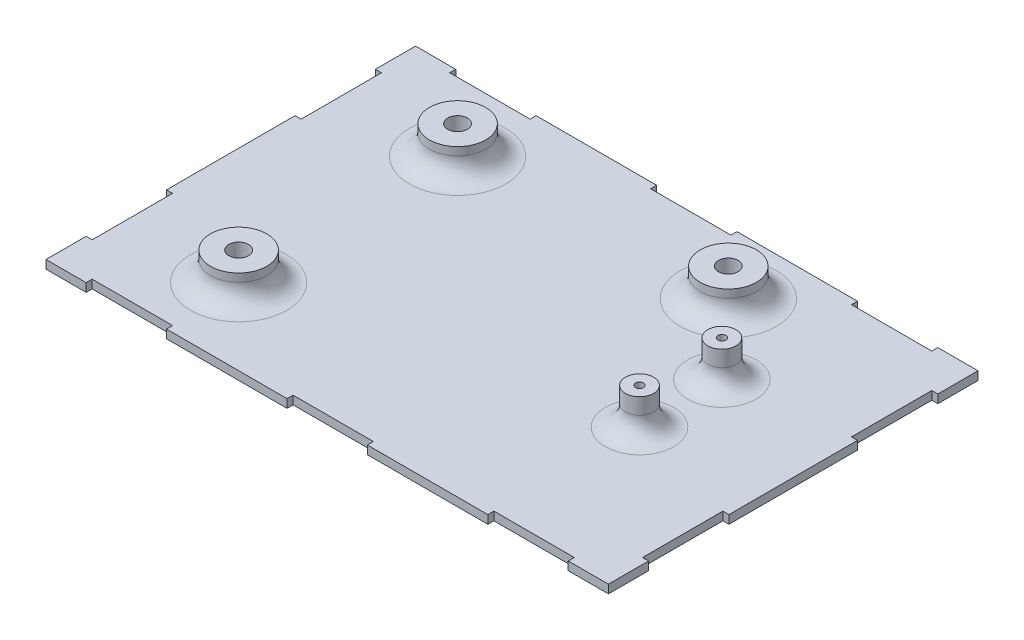
from build123d import *

# Parameters (mm, degrees)
SKETCH1_W           = 140
SKETCH1_H           = 92
BOSS_EXTRUDE1_DEPTH = 2.1
SKETCH2_W           = 1.5
SKETCH2_H           = 20
SKETCH2_W_2         = 20
SKETCH2_H_2         = 1.5
CUT_EXTRUDE1_DEPTH  = 84.787886953
SKETCH3_R           = 7
SKETCH3_R_2         = 3.5
BOSS_EXTRUDE2_DEPTH = 7
SKETCH6_R           = 3.5
BOSS_EXTRUDE3_DEPTH = 2
SKETCH7_R           = 2.45
CUT_EXTRUDE4_DEPTH  = 5.1
SKETCH8_R           = 1
CUT_EXTRUDE5_DEPTH  = 7
FILLET1_R           = 5


with BuildPart() as part:
    # Sketch1 → Boss-Extrude1 (new body)
    with BuildSketch(Plane(origin=(0, 0, 0), x_dir=(1, 0, 0), z_dir=(0, 1, 0))):
        Rectangle(SKETCH1_W, SKETCH1_H)
    extrude(amount=BOSS_EXTRUDE1_DEPTH)

    # Sketch2 → Cut-Extrude1 (cut, through all)
    with BuildSketch(Plane(origin=(0, 2.1, 0), x_dir=(1, 0, 0), z_dir=(0, 1, 0))):
        with Locations((69.25, 26)):
            Rectangle(SKETCH2_W, SKETCH2_H)
        with Locations((69.25, -26)):
            Rectangle(SKETCH2_W, SKETCH2_H)
        with Locations((50, -45.25)):
            Rectangle(SKETCH2_W_2, SKETCH2_H_2)
        with Locations((-50, -45.25)):
            Rectangle(SKETCH2_W_2, SKETCH2_H_2)
        with Locations((0, -45.25)):
            Rectangle(SKETCH2_W_2, SKETCH2_H_2)
        with Locations((-50, 45.25)):
            Rectangle(SKETCH2_W_2, SKETCH2_H_2)
        with Locations((0, 45.25)):
            Rectangle(SKETCH2_W_2, SKETCH2_H_2)
        with Locations((50, 45.25)):
            Rectangle(SKETCH2_W_2, SKETCH2_H_2)
        with Locations((-69.25, 26)):
            Rectangle(SKETCH2_W, SKETCH2_H)
        with Locations((-69.25, -26)):
            Rectangle(SKETCH2_W, SKETCH2_H)
    extrude(amount=-CUT_EXTRUDE1_DEPTH, mode=Mode.SUBTRACT)

    # Sketch3 → Boss-Extrude2 (add)
    with BuildSketch(Plane(origin=(0, 2.1, 0), x_dir=(1, 0, 0), z_dir=(0, 1, 0))):
        with Locations(Location((-41.05, 27.5, 0), (0, 0, 90))):
            Circle(SKETCH3_R)
        with Locations(Location((-41.05, -27, 0), (0, 0, 90))):
            Circle(SKETCH3_R)
        with Locations(Location((23.35, 30.5, 0), (0, 0, 90))):
            Circle(SKETCH3_R)
        with Locations(Location((40, 12.25, 0), (0, 0, 90))):
            Circle(SKETCH3_R_2)
        with Locations(Location((40, -8.25, 0), (0, 0, 90))):
            Circle(SKETCH3_R_2)
    extrude(amount=BOSS_EXTRUDE2_DEPTH)

    # Sketch6 → Boss-Extrude3 (add)
    with BuildSketch(Plane(origin=(0, 9.1, 0), x_dir=(1, 0, 0), z_dir=(0, 1, 0))):
        with Locations(Location((40, 12.25, 0), (0, 0, 90))):
            Circle(SKETCH6_R)
        with Locations(Location((40, -8.25, 0), (0, 0, 90))):
            Circle(SKETCH6_R)
    extrude(amount=BOSS_EXTRUDE3_DEPTH)

    # Sketch7 → Cut-Extrude4 (cut)
    with BuildSketch(Plane(origin=(0, 9.1, 0), x_dir=(1, 0, 0), z_dir=(0, 1, 0))):
        with Locations(Location((-41.05, 27.5, 0), (0, 0, 270))):
            Circle(SKETCH7_R)
        with Locations(Location((23.35, 30.5, 0), (0, 0, 270))):
            Circle(SKETCH7_R)
        with Locations(Location((-41.05, -27, 0), (0, 0, 270))):
            Circle(SKETCH7_R)
    extrude(amount=-CUT_EXTRUDE4_DEPTH, mode=Mode.SUBTRACT)

    # Sketch8 → Cut-Extrude5 (cut)
    with BuildSketch(Plane(origin=(0, 11.1, 0), x_dir=(1, 0, 0), z_dir=(0, 1, 0))):
        with Locations(Location((40, 12.25, 0), (0, 0, 270))):
            Circle(SKETCH8_R)
        with Locations(Location((40, -8.25, 0), (0, 0, 270))):
            Circle(SKETCH8_R)
    extrude(amount=-CUT_EXTRUDE5_DEPTH, mode=Mode.SUBTRACT)

    # Fillet1
    fillet1_edges = [part.edges().sort_by_distance(p)[0] for p in [
        (-41.05, 2.1, -20.5),
        (-41.05, 2.1, 34),
        (23.35, 2.1, -23.5),
        (40, 2.1, -8.75),
        (40, 2.1, 11.75),
    ]]
    fillet(fillet1_edges, radius=FILLET1_R)


solid = part.part
